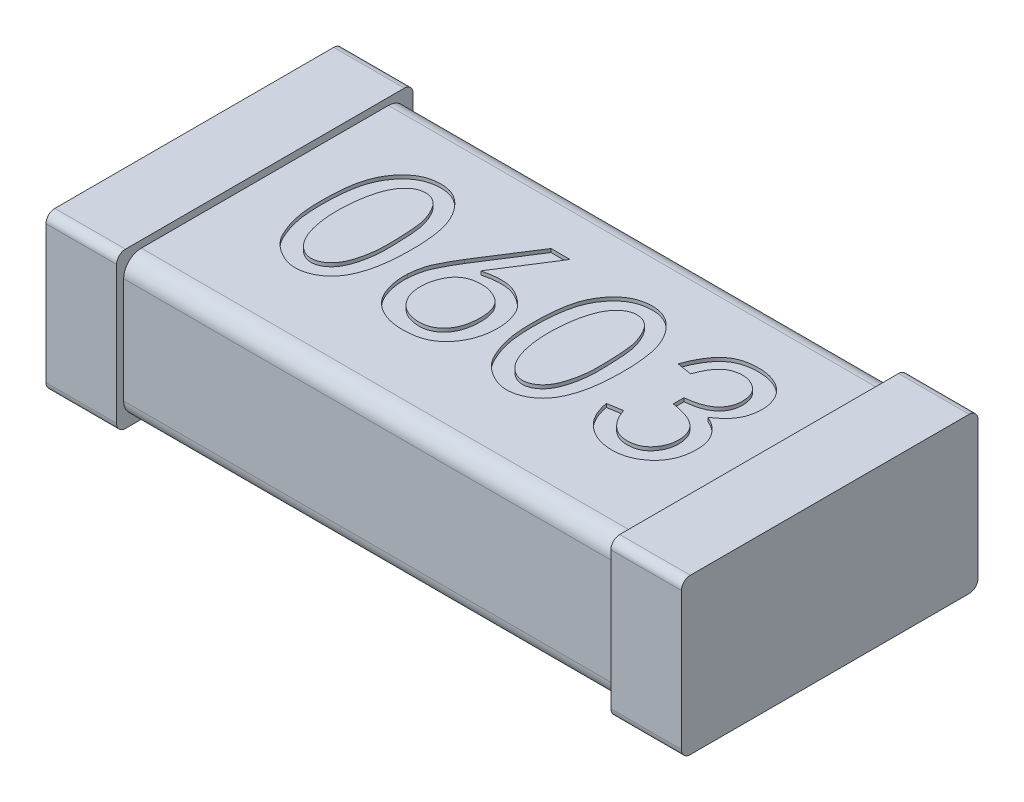
from build123d import *

# Parameters (mm, degrees)
SKETCH_1_W          = 1.6
SKETCH_1_H          = 0.8
EXTRUDE_1_DEPTH     = 0.4
EXTRUDE_2_DEPTH     = 0.2
EXTRUDE_3_DEPTH     = 0.2
FILLET_1_R          = 0.05
CUT_EXTRUDE_1_DEPTH = 0.01


with BuildPart() as part:
    # 草图1 → 凸台-拉伸1 (new body)
    with BuildSketch(Plane(origin=(0, 0, 0), x_dir=(1, 0, 0), z_dir=(0, 1, 0))):
        Rectangle(SKETCH_1_W, SKETCH_1_H)
    extrude(amount=EXTRUDE_1_DEPTH)

    # 草图2 → 凸台-拉伸2 (add)
    with BuildSketch(Plane(origin=(0.8, 0, 0), x_dir=(0, 0, -1), z_dir=(1, 0, 0))):
        with BuildLine():
            Line((-0.395, 0.42), (0.395, 0.42))
            ThreePointArc((0.395, 0.42), (0.41267767, 0.41267767), (0.42, 0.395))
            Line((0.42, 0.395), (0.42, 0.005))
            ThreePointArc((0.42, 0.005), (0.41267767, -0.01267767), (0.395, -0.02))
            Line((0.395, -0.02), (-0.395, -0.02))
            ThreePointArc((-0.395, -0.02), (-0.41267767, -0.01267767), (-0.42, 0.005))
            Line((-0.42, 0.005), (-0.42, 0.395))
            ThreePointArc((-0.42, 0.395), (-0.41267767, 0.41267767), (-0.395, 0.42))
        make_face()
    extrude(amount=-EXTRUDE_2_DEPTH)

    # 草图4 → 凸台-拉伸3 (add)
    with BuildSketch(Plane.ZY.offset(0.8)):
        with BuildLine():
            Line((-0.42, 0.005), (-0.42, 0.395))
            ThreePointArc((-0.42, 0.395), (-0.41267767, 0.41267767), (-0.395, 0.42))
            Line((-0.395, 0.42), (0.395, 0.42))
            ThreePointArc((0.395, 0.42), (0.41267767, 0.41267767), (0.42, 0.395))
            Line((0.42, 0.395), (0.42, 0.005))
            ThreePointArc((0.42, 0.005), (0.41267767, -0.01267767), (0.395, -0.02))
            Line((0.395, -0.02), (-0.395, -0.02))
            ThreePointArc((-0.395, -0.02), (-0.41267767, -0.01267767), (-0.42, 0.005))
        make_face()
    extrude(amount=EXTRUDE_3_DEPTH)

    # 圆角1
    fillet_1_edges = [part.edges().sort_by_distance(p)[0] for p in [
        (-0.1, 0, -0.4),
        (-0.1, 0.4, -0.4),
        (-0.1, 0, 0.4),
        (-0.1, 0.4, 0.4),
    ]]
    fillet(fillet_1_edges, radius=FILLET_1_R)

    # 草图5 → 切除-拉伸1 (cut)
    # profile 1 of 4: a face of its own
    with BuildSketch(Plane(origin=(0, 0.4, 0), x_dir=(1, 0, 0), z_dir=(0, 1, 0))):
        with BuildLine():
            add(Edge.make_bspline(
                [(-0.661052935, 0.050375559), (-0.660830184, 0.055402813), (-0.660395727, 0.065208033), (-0.659140491, 0.079505149), (-0.657624665, 0.093036165), (-0.655653892, 0.1057597), (-0.653218115, 0.117633403), (-0.650461116, 0.128719503), (-0.647274968, 0.138986981), (-0.642583433, 0.151526578), (-0.635548252, 0.165959502), (-0.625485195, 0.18182232), (-0.613791589, 0.196081878), (-0.602729065, 0.206530322), (-0.593137109, 0.213883986), (-0.585473319, 0.218658482), (-0.577421783, 0.222737929), (-0.568956096, 0.226064804), (-0.560091828, 0.228543005), (-0.55085246, 0.230372635), (-0.541207501, 0.231504472), (-0.531268846, 0.231841208), (-0.521255301, 0.231369717), (-0.511418427, 0.229833732), (-0.501926016, 0.227106967), (-0.492771585, 0.223363548), (-0.483980048, 0.218553719), (-0.475507152, 0.212716116), (-0.467453344, 0.205699769), (-0.459718246, 0.197789577), (-0.452493439, 0.189083781), (-0.445875531, 0.179750397), (-0.439892014, 0.169885697), (-0.434622643, 0.159435563), (-0.429899278, 0.148492142), (-0.425936795, 0.136957959), (-0.422658523, 0.124879874), (-0.419048633, 0.107817459), (-0.415872712, 0.085184608), (-0.413635235, 0.056540072), (-0.413124677, 0.025996974), (-0.413884907, -0.000416553), (-0.415317957, -0.021817603), (-0.416947177, -0.037340051), (-0.419135501, -0.052071466), (-0.421682971, -0.066083554), (-0.42487001, -0.079301797), (-0.428646686, -0.091740359), (-0.432727215, -0.103480498), (-0.437530217, -0.114398807), (-0.442761441, -0.124588009), (-0.448725483, -0.133917585), (-0.455186689, -0.142513553), (-0.46231634, -0.150307792), (-0.470207322, -0.157143296), (-0.478585098, -0.163349902), (-0.487674658, -0.168632424), (-0.497233792, -0.173115157), (-0.50707898, -0.176682842), (-0.51708731, -0.179008154), (-0.52706998, -0.180390225), (-0.537097337, -0.180395281), (-0.547109972, -0.179523449), (-0.557066763, -0.177230043), (-0.567090527, -0.174076859), (-0.576912772, -0.169617659), (-0.58636645, -0.164483114), (-0.595264882, -0.158956801), (-0.603364886, -0.15294338), (-0.61073118, -0.146521542), (-0.617455657, -0.139745205), (-0.623458958, -0.13255004), (-0.628678773, -0.124916123), (-0.634511821, -0.1141724), (-0.640760879, -0.1003143), (-0.647228618, -0.083244449), (-0.652514724, -0.065764004), (-0.655913798, -0.050742152), (-0.658154802, -0.038175224), (-0.659387807, -0.027873472), (-0.660458857, -0.01678404), (-0.661106169, -0.004904346), (-0.66153674, 0.007775911), (-0.661724132, 0.021265763), (-0.661523562, 0.035563642), (-0.66121258, 0.045351086), (-0.661052935, 0.050375559)],
                knots=[0, 0, 0, 0, 1.18043416, 2.302333746, 3.366253517, 4.374302266, 5.321670991, 6.208995316, 7.053297808, 7.84229274, 9.348259463, 10.810477328, 12.240076564, 13.663562249, 14.3695339, 15.072606272, 15.778577923, 16.484387009, 17.202829605, 17.934942377, 18.692112664, 19.478485278, 20.265441384, 21.040673806, 21.808439453, 22.577161074, 23.356320991, 24.155029842, 24.986154494, 25.858111265, 26.748121484, 27.637306138, 28.540117759, 29.452135788, 30.380885827, 31.334339875, 32.310628684, 33.31521083, 35.42407972, 37.666773946, 40.052062172, 42.587025658, 43.863776122, 45.083322308, 46.247467896, 47.357025429, 48.423487632, 49.435172604, 50.405897663, 51.337337341, 52.231284254, 53.090220275, 53.931690991, 54.751583713, 55.562922169, 56.377338113, 57.194202079, 58.024663732, 58.851830165, 59.645552351, 60.431282623, 61.21044254, 61.99312915, 62.783838437, 63.60230231, 64.454612977, 65.309477934, 66.125301685, 66.909862715, 67.67340185, 68.415973016, 69.147238889, 69.868837108, 70.581506411, 72.0124375, 73.431838244, 74.861437481, 76.292961888, 77.042577341, 77.855187732, 78.726196438, 79.655959089, 80.645695907, 81.702690171, 82.820655125, 84, 84, 84, 84], degree=3))
        make_face()
        with BuildLine():
            add(Edge.make_bspline(
                [(-0.611930128, 0.064410647), (-0.612461197, 0.059129215), (-0.61350742, 0.048724611), (-0.614363105, 0.033289584), (-0.614606952, 0.018291489), (-0.614383654, 0.003724263), (-0.613522513, -0.010383594), (-0.612053262, -0.024059383), (-0.609960356, -0.037293504), (-0.607398824, -0.050050863), (-0.604329757, -0.062127557), (-0.600690089, -0.073359507), (-0.59654727, -0.08366489), (-0.59196434, -0.093059231), (-0.586933683, -0.101553742), (-0.581361623, -0.10910019), (-0.575404489, -0.115859111), (-0.568884253, -0.121539184), (-0.562196801, -0.12630922), (-0.555359627, -0.130015493), (-0.54848424, -0.13264176), (-0.541544398, -0.134247573), (-0.534565116, -0.134760299), (-0.527543611, -0.134263649), (-0.520531821, -0.132530212), (-0.513564575, -0.129873477), (-0.506841765, -0.126214315), (-0.500481752, -0.12179586), (-0.494617143, -0.116519278), (-0.489244839, -0.110441208), (-0.484395558, -0.103524053), (-0.479958553, -0.095886069), (-0.476062526, -0.087400568), (-0.471481133, -0.074976282), (-0.466867233, -0.058430462), (-0.462762372, -0.037755047), (-0.460341224, -0.016193283), (-0.459706424, 0.00592908), (-0.46011917, 0.027910381), (-0.460614207, 0.049204179), (-0.461804542, 0.069450677), (-0.463229137, 0.088752971), (-0.465646806, 0.107197241), (-0.47010225, 0.124686881), (-0.476343018, 0.141269315), (-0.48274849, 0.154359459), (-0.488887315, 0.163861429), (-0.493726694, 0.170236977), (-0.499106849, 0.175564513), (-0.504779911, 0.180106268), (-0.510877847, 0.183564001), (-0.517345512, 0.186150467), (-0.524180081, 0.18775332), (-0.531277978, 0.188543657), (-0.538428865, 0.188405495), (-0.545452764, 0.18715038), (-0.552265233, 0.184955358), (-0.55890914, 0.181830478), (-0.565245089, 0.177601038), (-0.571374356, 0.172424598), (-0.57722789, 0.166213992), (-0.582993998, 0.159137775), (-0.588253693, 0.150920907), (-0.59311798, 0.141716471), (-0.597431698, 0.131406204), (-0.601295078, 0.120049778), (-0.604764766, 0.107647811), (-0.607682076, 0.09419284), (-0.610102927, 0.079674143), (-0.611307178, 0.069614453), (-0.611930128, 0.064410647)],
                knots=[0, 0, 0, 0, 1.378198314, 2.715098627, 4.012594964, 5.272602849, 6.497213731, 7.681415101, 8.842769074, 9.975170128, 11.059162755, 12.076494648, 13.038717388, 13.940857576, 14.788360499, 15.598271168, 16.373595835, 17.122768248, 17.838466736, 18.502782022, 19.136468245, 19.744060339, 20.345653328, 20.947246317, 21.563841626, 22.214212994, 22.87852828, 23.546305104, 24.220743313, 24.921956094, 25.648106704, 26.41081768, 27.212668989, 28.069279432, 29.84713992, 31.666334073, 33.537864714, 35.473745168, 37.408579624, 39.246547954, 41.003985019, 42.674193204, 44.272363647, 45.827394737, 47.348405091, 48.867584295, 49.599750274, 50.283750763, 50.94125936, 51.560811542, 52.165388272, 52.754418158, 53.363720025, 53.982318455, 54.604903792, 55.213928724, 55.828148287, 56.458765578, 57.113918044, 57.800421407, 58.537638978, 59.326979919, 60.167286366, 61.066273245, 62.027297208, 63.065989643, 64.179487018, 65.369443928, 66.639232213, 68, 68, 68, 68], degree=3))
        make_face(mode=Mode.SUBTRACT)
    # profile 2 of 4: a face of its own
    with BuildSketch(Plane(origin=(0, 0.4, 0), x_dir=(1, 0, 0), z_dir=(0, 1, 0))):
        with BuildLine():
            add(Edge.make_bspline(
                [(-0.062222526, 0.050375559), (-0.061999775, 0.055402813), (-0.061565318, 0.065208033), (-0.060310081, 0.079505149), (-0.058794256, 0.093036165), (-0.056823483, 0.1057597), (-0.054387706, 0.117633403), (-0.051630706, 0.128719503), (-0.048444559, 0.138986981), (-0.043753023, 0.151526578), (-0.036717842, 0.165959502), (-0.026654786, 0.18182232), (-0.014961179, 0.196081878), (-0.003898656, 0.206530322), (0.0056933, 0.213883986), (0.013357091, 0.218658482), (0.021408627, 0.222737929), (0.029874313, 0.226064804), (0.038738582, 0.228543005), (0.047977949, 0.230372635), (0.057622908, 0.231504472), (0.067561564, 0.231841208), (0.077575108, 0.231369717), (0.087411982, 0.229833732), (0.096904394, 0.227106967), (0.106058824, 0.223363548), (0.114850361, 0.218553719), (0.123323258, 0.212716116), (0.131377066, 0.205699769), (0.139112163, 0.197789577), (0.146336971, 0.189083781), (0.152954878, 0.179750397), (0.158938395, 0.169885697), (0.164207766, 0.159435563), (0.168931131, 0.148492142), (0.172893614, 0.136957959), (0.176171886, 0.124879874), (0.179781777, 0.107817459), (0.182957698, 0.085184608), (0.185195174, 0.056540072), (0.185705732, 0.025996974), (0.184945502, -0.000416553), (0.183512452, -0.021817603), (0.181883233, -0.037340051), (0.179694908, -0.052071466), (0.177147438, -0.066083554), (0.173960399, -0.079301797), (0.170183723, -0.091740359), (0.166103195, -0.103480498), (0.161300192, -0.114398807), (0.156068969, -0.124588009), (0.150104927, -0.133917585), (0.14364372, -0.142513553), (0.13651407, -0.150307792), (0.128623087, -0.157143296), (0.120245311, -0.163349902), (0.111155751, -0.168632424), (0.101596618, -0.173115157), (0.09175143, -0.176682842), (0.0817431, -0.179008154), (0.071760429, -0.180390225), (0.061733072, -0.180395281), (0.051720438, -0.179523449), (0.041763646, -0.177230043), (0.031739882, -0.174076859), (0.021917638, -0.169617659), (0.012463959, -0.164483114), (0.003565527, -0.158956801), (-0.004534476, -0.15294338), (-0.01190077, -0.146521542), (-0.018625248, -0.139745205), (-0.024628549, -0.13255004), (-0.029848364, -0.124916123), (-0.035681412, -0.1141724), (-0.041930469, -0.1003143), (-0.048398209, -0.083244449), (-0.053684315, -0.065764004), (-0.057083388, -0.050742152), (-0.059324393, -0.038175224), (-0.060557398, -0.027873472), (-0.061628448, -0.01678404), (-0.06227576, -0.004904346), (-0.062706331, 0.007775911), (-0.062893723, 0.021265763), (-0.062693153, 0.035563642), (-0.062382171, 0.045351086), (-0.062222526, 0.050375559)],
                knots=[0, 0, 0, 0, 1.18043416, 2.302333746, 3.366253517, 4.374302266, 5.321670991, 6.208995316, 7.053297808, 7.84229274, 9.348259463, 10.810477328, 12.240076564, 13.663562249, 14.3695339, 15.072606272, 15.778577923, 16.484387009, 17.202829605, 17.934942377, 18.692112664, 19.478485278, 20.265441384, 21.040673806, 21.808439453, 22.577161074, 23.356320991, 24.155029842, 24.986154494, 25.858111265, 26.748121484, 27.637306138, 28.540117759, 29.452135788, 30.380885827, 31.334339875, 32.310628684, 33.31521083, 35.42407972, 37.666773946, 40.052062172, 42.587025658, 43.863776122, 45.083322308, 46.247467896, 47.357025429, 48.423487632, 49.435172604, 50.405897663, 51.337337341, 52.231284254, 53.090220275, 53.931690991, 54.751583713, 55.562922169, 56.377338113, 57.194202079, 58.024663732, 58.851830165, 59.645552351, 60.431282623, 61.21044254, 61.99312915, 62.783838437, 63.60230231, 64.454612977, 65.309477934, 66.125301685, 66.909862715, 67.67340185, 68.415973016, 69.147238889, 69.868837108, 70.581506411, 72.0124375, 73.431838244, 74.861437481, 76.292961888, 77.042577341, 77.855187732, 78.726196438, 79.655959089, 80.645695907, 81.702690171, 82.820655125, 84, 84, 84, 84], degree=3))
        make_face()
        with BuildLine():
            add(Edge.make_bspline(
                [(-0.013099719, 0.064410647), (-0.013630788, 0.059129215), (-0.014677011, 0.048724611), (-0.015532695, 0.033289584), (-0.015776542, 0.018291489), (-0.015553245, 0.003724263), (-0.014692104, -0.010383594), (-0.013222852, -0.024059383), (-0.011129947, -0.037293504), (-0.008568415, -0.050050863), (-0.005499347, -0.062127557), (-0.001859679, -0.073359507), (0.002283139, -0.08366489), (0.00686607, -0.093059231), (0.011896727, -0.101553742), (0.017468787, -0.10910019), (0.02342592, -0.115859111), (0.029946157, -0.121539184), (0.036633608, -0.12630922), (0.043470783, -0.130015493), (0.050346169, -0.13264176), (0.057286011, -0.134247573), (0.064265293, -0.134760299), (0.071286798, -0.134263649), (0.078298588, -0.132530212), (0.085265834, -0.129873477), (0.091988644, -0.126214315), (0.098348658, -0.12179586), (0.104213266, -0.116519278), (0.109585571, -0.110441208), (0.114434851, -0.103524053), (0.118871856, -0.095886069), (0.122767883, -0.087400568), (0.127349276, -0.074976282), (0.131963176, -0.058430462), (0.136068038, -0.037755047), (0.138489186, -0.016193283), (0.139123985, 0.00592908), (0.138711239, 0.027910381), (0.138216202, 0.049204179), (0.137025867, 0.069450677), (0.135601273, 0.088752971), (0.133183603, 0.107197241), (0.128728159, 0.124686881), (0.122487391, 0.141269315), (0.116081919, 0.154359459), (0.109943095, 0.163861429), (0.105103715, 0.170236977), (0.09972356, 0.175564513), (0.094050499, 0.180106268), (0.087952562, 0.183564001), (0.081484898, 0.186150467), (0.074650329, 0.18775332), (0.067552432, 0.188543657), (0.060401544, 0.188405495), (0.053377646, 0.18715038), (0.046565176, 0.184955358), (0.039921269, 0.181830478), (0.03358532, 0.177601038), (0.027456054, 0.172424598), (0.021602519, 0.166213992), (0.015836411, 0.159137775), (0.010576717, 0.150920907), (0.005712429, 0.141716471), (0.001398711, 0.131406204), (-0.002464669, 0.120049778), (-0.005934357, 0.107647811), (-0.008851667, 0.09419284), (-0.011272518, 0.079674143), (-0.012476769, 0.069614453), (-0.013099719, 0.064410647)],
                knots=[0, 0, 0, 0, 1.378198314, 2.715098627, 4.012594964, 5.272602849, 6.497213731, 7.681415101, 8.842769074, 9.975170128, 11.059162755, 12.076494648, 13.038717388, 13.940857576, 14.788360499, 15.598271168, 16.373595835, 17.122768248, 17.838466736, 18.502782022, 19.136468245, 19.744060339, 20.345653328, 20.947246317, 21.563841626, 22.214212994, 22.87852828, 23.546305104, 24.220743313, 24.921956094, 25.648106704, 26.41081768, 27.212668989, 28.069279432, 29.84713992, 31.666334073, 33.537864714, 35.473745168, 37.408579624, 39.246547954, 41.003985019, 42.674193204, 44.272363647, 45.827394737, 47.348405091, 48.867584295, 49.599750274, 50.283750763, 50.94125936, 51.560811542, 52.165388272, 52.754418158, 53.363720025, 53.982318455, 54.604903792, 55.213928724, 55.828148287, 56.458765578, 57.113918044, 57.800421407, 58.537638978, 59.326979919, 60.167286366, 61.066273245, 62.027297208, 63.065989643, 64.179487018, 65.369443928, 66.639232213, 68, 68, 68, 68], degree=3))
        make_face(mode=Mode.SUBTRACT)
    # profile 3 of 4: a face of its own
    with BuildSketch(Plane(origin=(0, 0.4, 0), x_dir=(1, 0, 0), z_dir=(0, 1, 0))):
        with BuildLine():
            add(Edge.make_bspline(
                [(-0.359298549, -0.036174148), (-0.358848016, -0.030732183), (-0.357975655, -0.020194991), (-0.355121255, -0.005184401), (-0.351587043, 0.00861634), (-0.346601039, 0.02141548), (-0.340219158, 0.034151234), (-0.333121872, 0.048126291), (-0.324462781, 0.063438423), (-0.318165963, 0.07406796), (-0.314854105, 0.079658643)],
                knots=[0, 0, 0, 0, 1.042998706, 2.019541814, 2.916615498, 3.762308625, 4.638715294, 5.638536551, 6.75797084, 8, 8, 8, 8], degree=3))
            Line((-0.314854105, 0.079658643), (-0.218947672, 0.229366246))
            Line((-0.218947672, 0.229366246), (-0.165146503, 0.229366246))
            Line((-0.165146503, 0.229366246), (-0.263392117, 0.074980281))
            add(Edge.make_bspline(
                [(-0.263392117, 0.074980281), (-0.258267125, 0.07623629), (-0.248368002, 0.078662321), (-0.233742049, 0.081015411), (-0.219923989, 0.082166167), (-0.206909718, 0.082199238), (-0.194680732, 0.081122718), (-0.183249214, 0.078792457), (-0.172599395, 0.075237705), (-0.16283256, 0.070501858), (-0.153926061, 0.065121907), (-0.145728068, 0.059545664), (-0.1382594, 0.05385683), (-0.131570644, 0.04795323), (-0.125600472, 0.041889229), (-0.120544616, 0.035522271), (-0.115990574, 0.029138155), (-0.111389443, 0.020170065), (-0.106558664, 0.008661429), (-0.102336718, -0.00575919), (-0.099536974, -0.020765776), (-0.09831403, -0.036205205), (-0.098324236, -0.05187101), (-0.100049061, -0.067493677), (-0.103040294, -0.083003197), (-0.107651621, -0.098250733), (-0.113810223, -0.113202516), (-0.122262268, -0.12741652), (-0.132744452, -0.14090865), (-0.143040642, -0.151329562), (-0.15222687, -0.159122185), (-0.160055674, -0.164124288), (-0.168449973, -0.168556441), (-0.177530722, -0.172288246), (-0.187235788, -0.175331659), (-0.197631627, -0.177528228), (-0.208650626, -0.179199756), (-0.220172179, -0.180089642), (-0.23177479, -0.180401782), (-0.243112706, -0.179825758), (-0.254028695, -0.178750483), (-0.2645118, -0.176933834), (-0.274575805, -0.174427591), (-0.284144473, -0.171122601), (-0.293333222, -0.167202527), (-0.302033328, -0.162641634), (-0.310213745, -0.157468846), (-0.317643441, -0.151602988), (-0.324554694, -0.145391751), (-0.330716761, -0.138565998), (-0.336305968, -0.131295629), (-0.341120482, -0.123445763), (-0.345457819, -0.115178404), (-0.350026138, -0.103485291), (-0.354492247, -0.088656643), (-0.358054911, -0.070876002), (-0.359985767, -0.053394396), (-0.359525712, -0.04186637), (-0.359298549, -0.036174148)],
                knots=[0, 0, 0, 0, 1.30987361, 2.530072464, 3.674076933, 4.749737101, 5.758005553, 6.717161001, 7.640113921, 8.538216801, 9.406478839, 10.221965151, 10.999356528, 11.736024514, 12.43585607, 13.108943968, 13.753423114, 14.378993464, 15.606901413, 16.848076322, 18.102664827, 19.390785032, 20.688768111, 21.98673138, 23.287623163, 24.605715361, 25.936233508, 27.292778926, 28.698472844, 30.169013905, 30.922829238, 31.684618084, 32.470496446, 33.277520399, 34.118983406, 34.992471271, 35.913332431, 36.884634966, 37.860137434, 38.793368636, 39.701719614, 40.582389804, 41.432879653, 42.274220425, 43.093418803, 43.911360741, 44.711055379, 45.492833336, 46.259332936, 47.015702139, 47.772988627, 48.533121813, 49.299654956, 50.087983324, 51.646482558, 53.138633408, 54.587135849, 56, 56, 56, 56], degree=3))
        make_face()
        with BuildLine():
            add(Edge.make_bspline(
                [(-0.286783929, -0.113367131), (-0.284998573, -0.115137609), (-0.281415167, -0.118691151), (-0.275447024, -0.123318931), (-0.269046671, -0.127379166), (-0.2621967, -0.130707269), (-0.254949727, -0.133564951), (-0.247220611, -0.135541931), (-0.239106418, -0.13718954), (-0.230663834, -0.137967501), (-0.222163785, -0.138254773), (-0.213897077, -0.137397471), (-0.205958559, -0.135926305), (-0.198423655, -0.133321792), (-0.191222092, -0.129969751), (-0.184411842, -0.125689468), (-0.17805284, -0.120475595), (-0.172000553, -0.11456683), (-0.166520469, -0.107772735), (-0.161743304, -0.100177161), (-0.157672391, -0.091844332), (-0.154378456, -0.082781164), (-0.151897177, -0.073021599), (-0.15008608, -0.062565229), (-0.148959052, -0.051361728), (-0.148661544, -0.039696173), (-0.14901303, -0.028108242), (-0.150342456, -0.017184129), (-0.15272542, -0.007248799), (-0.155781903, 0.001830036), (-0.159951897, 0.009904554), (-0.165058625, 0.017052246), (-0.17103944, 0.023266597), (-0.177996308, 0.028340266), (-0.185386727, 0.032607686), (-0.193053058, 0.036174163), (-0.200902055, 0.039059333), (-0.208983182, 0.041248562), (-0.217341449, 0.042635735), (-0.225926652, 0.043211635), (-0.234703226, 0.043119448), (-0.243543452, 0.042357664), (-0.252216736, 0.04087701), (-0.260360826, 0.038421708), (-0.267944258, 0.035292768), (-0.27491632, 0.031325689), (-0.281156285, 0.026392486), (-0.286888794, 0.020810177), (-0.291910477, 0.014342355), (-0.297713565, 0.0047728), (-0.30345639, -0.008021688), (-0.308240435, -0.024044882), (-0.310575322, -0.040539805), (-0.310547954, -0.054459794), (-0.309437101, -0.065446063), (-0.307965816, -0.073389362), (-0.305861389, -0.080937545), (-0.303282306, -0.088174348), (-0.300059893, -0.095048395), (-0.296226278, -0.101567963), (-0.29183549, -0.107734304), (-0.28846642, -0.111491041), (-0.286783929, -0.113367131)],
                knots=[0, 0, 0, 0, 0.824379014, 1.654618615, 2.472217002, 3.307040171, 4.149944448, 5.023399345, 5.920986251, 6.863846236, 7.802124107, 8.706338671, 9.585327007, 10.445314643, 11.314286422, 12.187124327, 13.076521263, 14.007883694, 14.9579535, 15.93325223, 16.946080417, 17.995267438, 19.091535754, 20.245890406, 21.474436714, 22.782621587, 24.072176649, 25.275692408, 26.385796877, 27.419682211, 28.411368294, 29.355370333, 30.293504652, 31.227802789, 32.170424673, 33.090341057, 33.998667172, 34.911184711, 35.833391934, 36.773820451, 37.730905064, 38.710612777, 39.6827302, 40.612114241, 41.495534864, 42.369965774, 43.234275376, 44.098636918, 44.989546864, 45.912629924, 47.765713501, 49.573670898, 51.382745352, 53.211540175, 54.12612168, 55.003320594, 55.858492095, 56.694765964, 57.521374723, 58.34531796, 59.173662839, 60, 60, 60, 60], degree=3))
        make_face(mode=Mode.SUBTRACT)
    # profile 4 of 4: a face of its own
    with BuildSketch(Plane(origin=(0, 0.4, 0), x_dir=(1, 0, 0), z_dir=(0, 1, 0))):
        with BuildLine():
            Line((0.23953186, -0.07238814), (0.281637123, -0.065370596))
            add(Edge.make_bspline(
                [(0.281637123, -0.065370596), (0.283296828, -0.070275574), (0.286556712, -0.079909612), (0.2936005, -0.093214755), (0.30201958, -0.105219848), (0.310096741, -0.114210197), (0.317397625, -0.1203495), (0.323156003, -0.124366897), (0.329207797, -0.127813336), (0.335723594, -0.13034197), (0.34246318, -0.132517917), (0.349608401, -0.133739287), (0.357021853, -0.134437099), (0.36464987, -0.134557123), (0.372252588, -0.133862082), (0.379594915, -0.1324726), (0.386560644, -0.130418566), (0.393120707, -0.127550035), (0.39918247, -0.123833007), (0.404979434, -0.119606007), (0.410288763, -0.114524373), (0.41505966, -0.108743515), (0.419374604, -0.102538228), (0.423103659, -0.096054197), (0.426184125, -0.089334868), (0.42848552, -0.082377549), (0.430275433, -0.075232293), (0.431263216, -0.067853975), (0.431736873, -0.060263108), (0.431426714, -0.052556908), (0.430642064, -0.044947858), (0.429039157, -0.037675002), (0.426882931, -0.030866623), (0.424206499, -0.024394704), (0.42071948, -0.018481901), (0.416704535, -0.012951376), (0.412075941, -0.007870923), (0.406721025, -0.003269109), (0.400694322, 0.001002588), (0.393862568, 0.004947247), (0.386129913, 0.008412044), (0.377659772, 0.011752097), (0.368278965, 0.014566051), (0.358108307, 0.017154578), (0.347065007, 0.019418674), (0.339400687, 0.020579153), (0.335438293, 0.021179111)],
                knots=[0, 0, 0, 0, 1.854799748, 3.643076762, 5.375778243, 7.105784308, 7.958514958, 8.791774595, 9.621744654, 10.44880128, 11.294076632, 12.157496915, 13.041787632, 13.96367637, 14.889223527, 15.774908308, 16.640004354, 17.48869958, 18.334228731, 19.185637365, 20.057465777, 20.961908388, 21.86984341, 22.765285775, 23.641349219, 24.5158806, 25.390105247, 26.279235462, 27.181837661, 28.114543598, 29.042174801, 29.921843334, 30.780091711, 31.601551697, 32.427634894, 33.235597725, 34.049381879, 34.886366892, 35.762920031, 36.695625967, 37.710569643, 38.799256358, 39.959035312, 41.220118669, 42.562822875, 44, 44, 44, 44], degree=3))
            Line((0.335438293, 0.021179111), (0.335438293, 0.051588468))
            add(Edge.make_bspline(
                [(0.335438293, 0.051588468), (0.339402755, 0.051993267), (0.347076871, 0.052776847), (0.358104848, 0.054852408), (0.368317948, 0.057189917), (0.37767134, 0.060159966), (0.386196232, 0.063620538), (0.393926665, 0.067552644), (0.400767409, 0.07211483), (0.406768391, 0.077155737), (0.412016025, 0.082635802), (0.416443837, 0.088553968), (0.420135792, 0.0948481), (0.42301831, 0.101572388), (0.425050895, 0.108713494), (0.426509531, 0.116217271), (0.426940035, 0.124127566), (0.426787731, 0.132269828), (0.425916402, 0.140332274), (0.42406096, 0.147972807), (0.421448702, 0.155038335), (0.41811457, 0.161601519), (0.413756479, 0.167452502), (0.408722254, 0.17278108), (0.402853097, 0.177481933), (0.396288639, 0.181519297), (0.389262772, 0.184816713), (0.382072348, 0.18750153), (0.374717843, 0.189112078), (0.367290109, 0.189986048), (0.35972822, 0.190122604), (0.352069372, 0.189179521), (0.344290015, 0.187527471), (0.336443377, 0.18504828), (0.32863717, 0.181550758), (0.321316205, 0.176499855), (0.314470092, 0.170159152), (0.307862568, 0.162647246), (0.301909744, 0.153643212), (0.296157995, 0.143476189), (0.290852079, 0.131972855), (0.287869678, 0.123723592), (0.286315486, 0.119424725)],
                knots=[0, 0, 0, 0, 1.385117707, 2.68120955, 3.899080185, 5.026526245, 6.089471502, 7.095537128, 8.036926677, 8.942108935, 9.815771246, 10.669349366, 11.506404864, 12.347666396, 13.205663414, 14.084102859, 14.999917747, 15.954128211, 16.914501223, 17.813254747, 18.680661639, 19.529560311, 20.363114732, 21.208382436, 22.07252795, 22.96987783, 23.881720011, 24.767988279, 25.632833695, 26.492298631, 27.366018653, 28.255410494, 29.169296362, 30.128408489, 31.112431375, 32.1318401, 33.205217515, 34.351116983, 35.601710711, 36.950682265, 38.410935554, 40, 40, 40, 40], degree=3))
            Line((0.286315486, 0.119424725), (0.244210223, 0.126442269))
            add(Edge.make_bspline(
                [(0.244210223, 0.126442269), (0.246664659, 0.133217402), (0.251447349, 0.146419358), (0.260384643, 0.164983423), (0.270756967, 0.181713653), (0.280480483, 0.194340516), (0.289020984, 0.203408776), (0.29610334, 0.209254331), (0.303611005, 0.214567218), (0.311740281, 0.219012307), (0.32039475, 0.222803456), (0.329617158, 0.22570368), (0.33934951, 0.227960222), (0.349490754, 0.229491375), (0.359709393, 0.230302693), (0.369750171, 0.230632494), (0.379466609, 0.230126978), (0.388889725, 0.229267081), (0.397942918, 0.227569199), (0.406679668, 0.225346431), (0.4150452, 0.22235523), (0.423136287, 0.218940557), (0.430696427, 0.214856631), (0.437817349, 0.210384153), (0.44418993, 0.20519157), (0.450186111, 0.199702523), (0.455333841, 0.193459037), (0.460087314, 0.186837674), (0.464232079, 0.179681232), (0.467667403, 0.172023464), (0.470536819, 0.164093409), (0.472684033, 0.155880574), (0.474286025, 0.147522293), (0.475037647, 0.138934308), (0.475125612, 0.130215334), (0.474502181, 0.121295107), (0.473184814, 0.11220694), (0.471234465, 0.102973966), (0.468427682, 0.093746628), (0.464386162, 0.084772438), (0.459249357, 0.076102193), (0.453026841, 0.067723158), (0.445728437, 0.059643468), (0.437245445, 0.051964596), (0.427782898, 0.044445954), (0.420870836, 0.039897046), (0.417309638, 0.03755338)],
                knots=[0, 0, 0, 0, 2.088435488, 4.069504719, 5.960900737, 7.786563479, 8.680771598, 9.566313178, 10.444341104, 11.343825986, 12.247587673, 13.179685867, 14.142420713, 15.141886465, 16.150152099, 17.113396579, 18.05212794, 18.969441419, 19.854666253, 20.719823891, 21.58047219, 22.428151748, 23.263500765, 24.069461113, 24.861911808, 25.643808195, 26.422154676, 27.202794716, 28.005617324, 28.815006474, 29.633397489, 30.44783822, 31.273903418, 32.097929155, 32.94366283, 33.799737089, 34.68784804, 35.604243899, 36.533818883, 37.478357806, 38.450549751, 39.450331118, 40.49965591, 41.60193164, 42.764479089, 44, 44, 44, 44], degree=3))
            add(Edge.make_bspline(
                [(0.417309638, 0.03755338), (0.422536236, 0.03507973), (0.432768452, 0.030237015), (0.446451277, 0.020439747), (0.458197332, 0.008888065), (0.466326614, -0.002168575), (0.471820088, -0.011811002), (0.47509032, -0.019736452), (0.477590373, -0.028194344), (0.479396914, -0.037153461), (0.480543523, -0.046654597), (0.480830678, -0.056707655), (0.480495268, -0.067330711), (0.479365342, -0.078299574), (0.477559008, -0.089310723), (0.474660377, -0.099912763), (0.470953682, -0.109989117), (0.466317668, -0.119558362), (0.460714359, -0.128536908), (0.454096709, -0.136906458), (0.446759774, -0.144852077), (0.438436228, -0.152035181), (0.429617574, -0.158579279), (0.420362681, -0.164248626), (0.410838192, -0.169031273), (0.40100685, -0.172866552), (0.390875767, -0.175732496), (0.380467926, -0.177712038), (0.369746793, -0.178870949), (0.358849141, -0.178994418), (0.34797973, -0.178346478), (0.337398166, -0.176721439), (0.327135922, -0.174554324), (0.317285133, -0.171345442), (0.307733196, -0.167511127), (0.298649759, -0.162688319), (0.289884082, -0.157184652), (0.28152425, -0.150915695), (0.273696393, -0.143801091), (0.266579283, -0.135864804), (0.260106851, -0.127214695), (0.254632126, -0.117654644), (0.249585565, -0.107496276), (0.245526703, -0.096458314), (0.241971488, -0.084730792), (0.240357205, -0.076563757), (0.23953186, -0.07238814)],
                knots=[0, 0, 0, 0, 1.556863988, 3.047903747, 4.51274202, 5.983117829, 6.732724558, 7.500714565, 8.289161914, 9.10779992, 9.96267821, 10.866591561, 11.817204889, 12.826910154, 13.838355827, 14.822602624, 15.786048742, 16.729939345, 17.685039949, 18.633769323, 19.603521256, 20.596937443, 21.593797024, 22.562140776, 23.519904659, 24.464277043, 25.403497682, 26.355035653, 27.318261422, 28.307425488, 29.290655039, 30.251043242, 31.192037974, 32.115630974, 33.041191859, 33.964292232, 34.884727864, 35.830159304, 36.778345149, 37.732302073, 38.701115445, 39.685485474, 40.699027657, 41.756353326, 42.852875359, 44, 44, 44, 44], degree=3))
        make_face()
    extrude(amount=-CUT_EXTRUDE_1_DEPTH, mode=Mode.SUBTRACT)


solid = part.part
